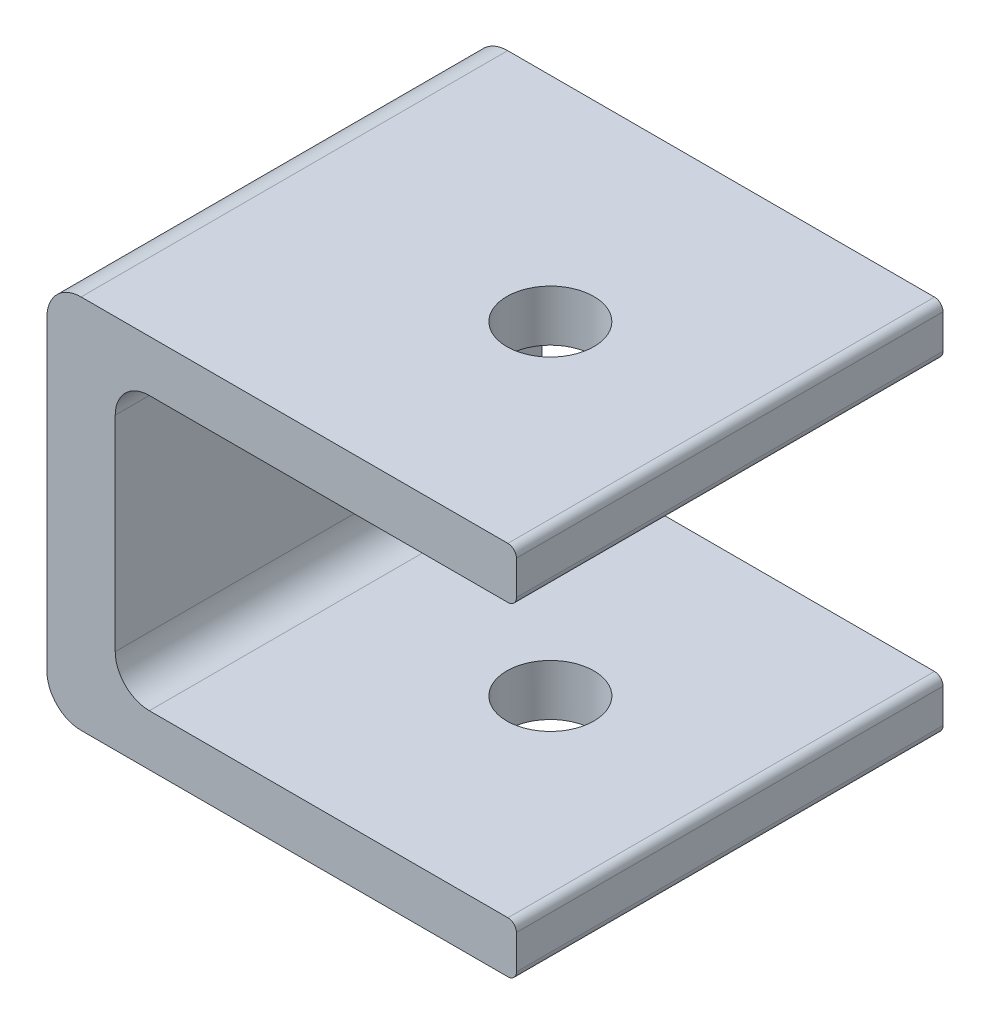
from build123d import *

# Parameters (mm, degrees)
EXTRUDE_1_DEPTH     = 25
SKETCH_2_R          = 2.55
CUT_EXTRUDE_1_DEPTH = 5
FILLET_1_R          = 2
FILLET_2_R          = 0.5
SKETCH_3_R          = 2.55
CUT_EXTRUDE_2_DEPTH = 35


with BuildPart() as part:
    # 草图1 → 凸台-拉伸1 (new body)
    with BuildSketch(Plane.XY):
        Polygon((0, 0), (23.51262021, 0), (23.51262021, 3), (0, 3), (-4, 3), (-4, -19), (0, -19), (23.51262021, -19), (23.51262021, -16), (0, -16), align=None)
    extrude(amount=EXTRUDE_1_DEPTH)

    # 草图2 → 切除-拉伸1 (cut)
    with BuildSketch(Plane.ZY.offset(4)):
        with Locations(Location((12.5, -8, 0), (0, 0, 270))):
            Circle(SKETCH_2_R)
    extrude(amount=-CUT_EXTRUDE_1_DEPTH, mode=Mode.SUBTRACT)

    # 圆角1
    fillet_1_edges = [part.edges().sort_by_distance(p)[0] for p in [
        (0, -16, 12.5),
        (-4, -19, 12.5),
        (-4, 3, 12.5),
        (0, 0, 12.5),
    ]]
    fillet(fillet_1_edges, radius=FILLET_1_R)

    # 圆角2
    fillet_2_edges = [part.edges().sort_by_distance(p)[0] for p in [
        (23.51262021, -16, 12.5),
        (23.51262021, -19, 12.5),
        (23.51262021, 3, 12.5),
        (23.51262021, 0, 12.5),
    ]]
    fillet(fillet_2_edges, radius=FILLET_2_R)

    # 草图3 → 切除-拉伸2 (cut)
    with BuildSketch(Plane(origin=(0, 3, 0), x_dir=(1, 0, 0), z_dir=(0, 1, 0))):
        with Locations(Location((13, -12.5, 0), (0, 0, 270))):
            Circle(SKETCH_3_R)
    extrude(amount=-CUT_EXTRUDE_2_DEPTH, mode=Mode.SUBTRACT)


solid = part.part
